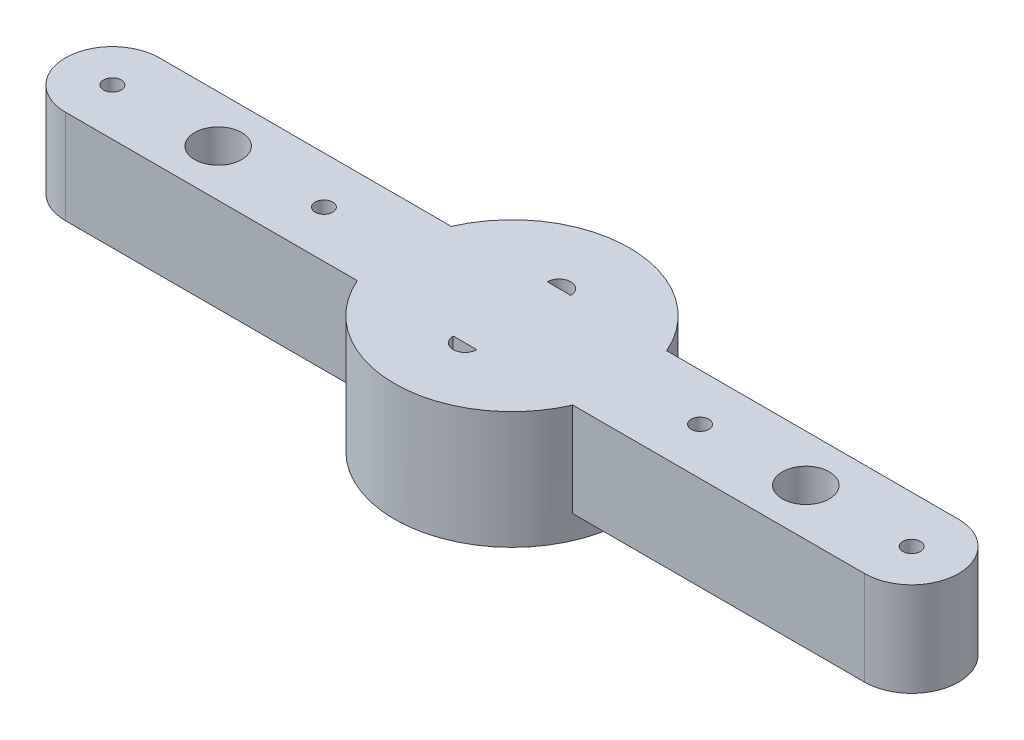
from build123d import *

# Parameters (mm, degrees)
SKETCH_1_R      = 0.75
SKETCH_1_R_2    = 2
EXTRUDE_1_DEPTH = 8
SKETCH_2_R      = 10
SKETCH_2_R_2    = 1
EXTRUDE_2_DEPTH = 10


with BuildPart() as part:
    # 草圖1 → 填料-伸長1 (new body)
    with BuildSketch(Plane(origin=(0, 0, 0), x_dir=(1, 0, 0), z_dir=(0, 1, 0))):
        with BuildLine():
            Line((-0.414012206, -4), (25, -4))
            Line((25, -4), (34, -4))
            ThreePointArc((34, -4), (38, 0), (34, 4))
            Line((34, 4), (25, 4))
            Line((25, 4), (-0.414012206, 4))
            Line((-0.414012206, 4), (-34, 4))
            ThreePointArc((-34, 4), (-38, 0), (-34, -4))
            Line((-34, -4), (-0.414012206, -4))
        make_face()
        with Locations(Location((34, 0, 0), (0, 0, 270))):
            Circle(SKETCH_1_R, mode=Mode.SUBTRACT)
        with Locations(Location((-34, 0, 0), (0, 0, 270))):
            Circle(SKETCH_1_R, mode=Mode.SUBTRACT)
        with Locations(Location((-25, 0, 0), (0, 0, 270))):
            Circle(SKETCH_1_R_2, mode=Mode.SUBTRACT)
        with Locations(Location((25, 0, 0), (0, 0, 270))):
            Circle(SKETCH_1_R_2, mode=Mode.SUBTRACT)
        with Locations(Location((-16, 0, 0), (0, 0, 270))):
            Circle(SKETCH_1_R, mode=Mode.SUBTRACT)
        with Locations(Location((16, 0, 0), (0, 0, 270))):
            Circle(SKETCH_1_R, mode=Mode.SUBTRACT)
    extrude(amount=EXTRUDE_1_DEPTH)

    # 草圖2 → 填料-伸長2 (add)
    with BuildSketch(Plane(origin=(0, 8, 0), x_dir=(-1, 0, 0), z_dir=(0, 1, 0))):
        with Locations(Location((0, 0, 0), (0, 0, 90))):
            Circle(SKETCH_2_R)
        with Locations(Location((0, -4, 0), (0, 0, 90))):
            Circle(SKETCH_2_R_2, mode=Mode.SUBTRACT)
        with Locations(Location((0, 4, 0), (0, 0, 90))):
            Circle(SKETCH_2_R_2, mode=Mode.SUBTRACT)
    extrude(amount=-EXTRUDE_2_DEPTH)


solid = part.part
